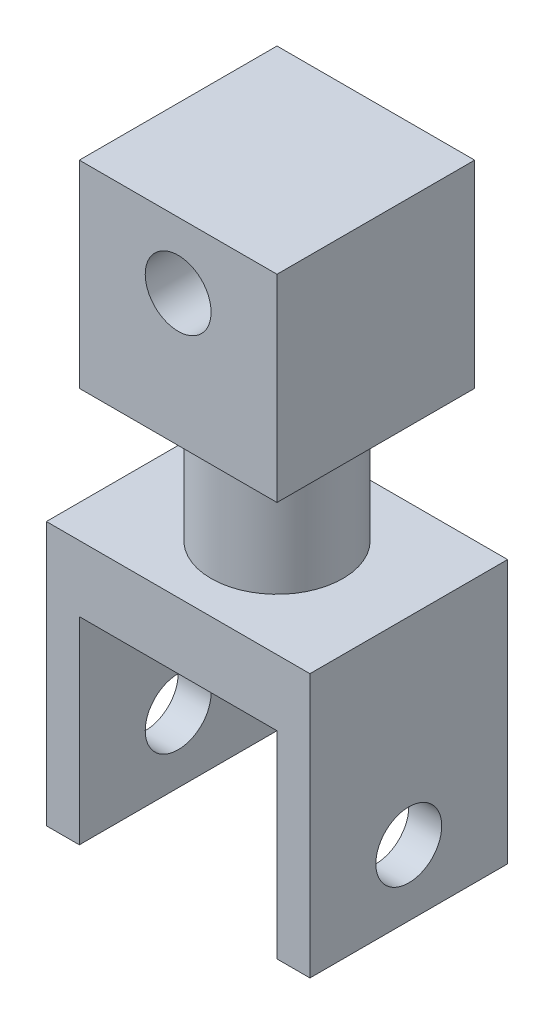
from build123d import *

# Parameters (mm, degrees)
SKETCH1_W           = 101.6
SKETCH1_H           = 76.2
BOSS_EXTRUDE1_DEPTH = 101.6
SKETCH3_W           = 76.2
SKETCH3_H           = 76.2
CUT_EXTRUDE1_DEPTH  = 76.2
SKETCH4_R           = 25.4
BOSS_EXTRUDE2_DEPTH = 50.8
SKETCH5_W           = 76.2
SKETCH5_H           = 76.2
BOSS_EXTRUDE3_DEPTH = 76.2
SKETCH6_R           = 12.7
CUT_EXTRUDE2_DEPTH  = 262.509005581
CUT_EXTRUDE3_REACH  = 263.509
SKETCH7_R           = 12.7


with BuildPart() as part:
    # Sketch1 → Boss-Extrude1 (new body)
    with BuildSketch(Plane(origin=(0, 0, 0), x_dir=(1, 0, 0), z_dir=(0, 1, 0))):
        with Locations((50.8, 38.1)):
            Rectangle(SKETCH1_W, SKETCH1_H)
    extrude(amount=BOSS_EXTRUDE1_DEPTH)

    # Sketch3 → Cut-Extrude1 (cut)
    with BuildSketch(Plane.XZ):
        with Locations((50.8, -38.1)):
            Rectangle(SKETCH3_W, SKETCH3_H)
    extrude(amount=-CUT_EXTRUDE1_DEPTH, mode=Mode.SUBTRACT)

    # Sketch4 → Boss-Extrude2 (add)
    with BuildSketch(Plane(origin=(0, 101.6, 0), x_dir=(1, 0, 0), z_dir=(0, 1, 0))):
        with Locations(Location((50.8, 38.1, 0), (0, 0, 270))):
            Circle(SKETCH4_R)
    extrude(amount=BOSS_EXTRUDE2_DEPTH)

    # Sketch5 → Boss-Extrude3 (add)
    with BuildSketch(Plane(origin=(0, 152.4, 0), x_dir=(1, 0, 0), z_dir=(0, 1, 0))):
        with Locations((50.8, 38.1)):
            Rectangle(SKETCH5_W, SKETCH5_H)
    extrude(amount=BOSS_EXTRUDE3_DEPTH)

    # Sketch6 → Cut-Extrude2 (cut, through all)
    with BuildSketch(Plane(origin=(101.6, 0, 0), x_dir=(0, 0, -1), z_dir=(1, 0, 0))):
        with Locations((38.1, 25.4)):
            Circle(SKETCH6_R)
    extrude(amount=-CUT_EXTRUDE2_DEPTH, mode=Mode.SUBTRACT)

    # Sketch7 → Cut-Extrude3 (cut, up to next)
    with BuildSketch(Plane(origin=(0, 0, -76.2), x_dir=(-1, 0, 0), z_dir=(0, 0, -1)), mode=Mode.PRIVATE) as cut_extrude3_sk1:
        with Locations((-50.8, 203.2)):
            Circle(SKETCH7_R)
    cut_extrude3_tool1 = extrude(cut_extrude3_sk1.sketch, amount=-CUT_EXTRUDE3_REACH, mode=Mode.PRIVATE) & part.part
    add(cut_extrude3_tool1.solids().sort_by_distance((50.8, 203.2, -76.2))[0], mode=Mode.SUBTRACT)


solid = part.part
